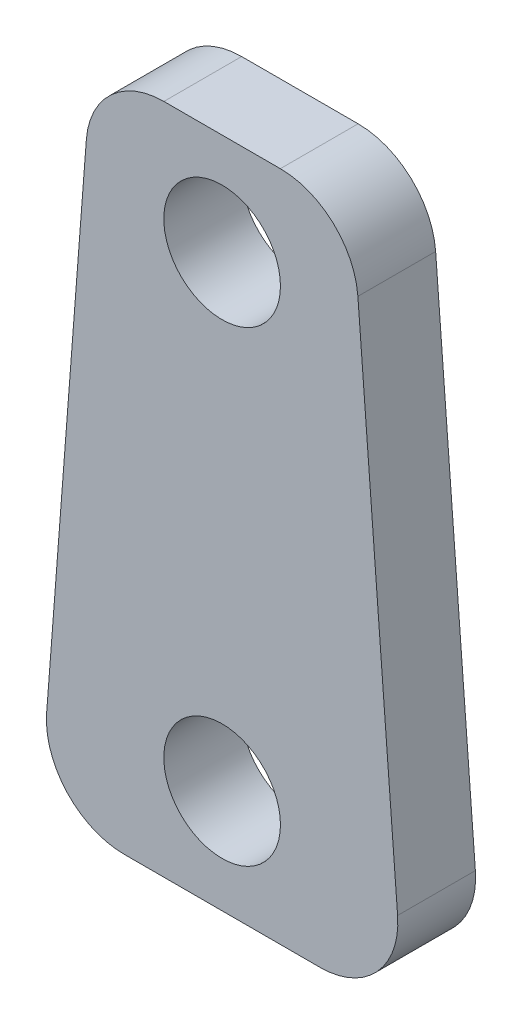
from build123d import *

# Parameters (mm, degrees)
BOSS_EXTRUDE1_DEPTH = 3.175


with BuildPart() as part:
    # Sketch1 → Boss-Extrude1 (new body)
    with BuildSketch(Plane.XY):
        with BuildLine():
            Line((0, 135.477250085), (0, 137.244666667))
            Line((0, 137.244666667), (-2.377569082, 137.244666667))
            ThreePointArc((-2.377569082, 137.244666667), (-4.534821542, 136.399234614), (-5.543217073, 134.313178051))
            Line((-5.543217073, 134.313178051), (-7.164909381, 113.231178051))
            ThreePointArc((-7.164909381, 113.231178051), (-6.328829337, 110.830414206), (-3.999261389, 109.812666667))
            Line((-3.999261389, 109.812666667), (0, 109.812666667))
            Line((0, 109.812666667), (0, 111.664750085))
            ThreePointArc((0, 111.664750085), (-2.38125, 114.046000085), (0, 116.427250085))
            Line((0, 116.427250085), (0, 130.714750085))
            ThreePointArc((0, 130.714750085), (-2.38125, 133.096000085), (0, 135.477250085))
        make_face()
        with BuildLine():
            Line((7.164909381, 113.231178051), (5.543217073, 134.313178051))
            ThreePointArc((5.543217073, 134.313178051), (4.534821542, 136.399234614), (2.377569082, 137.244666667))
            Line((2.377569082, 137.244666667), (0, 137.244666667))
            Line((0, 137.244666667), (0, 135.477250085))
            ThreePointArc((0, 135.477250085), (1.683798023, 134.779798107), (2.38125, 133.096000085))
            ThreePointArc((2.38125, 133.096000085), (1.683798023, 131.412202062), (0, 130.714750085))
            Line((0, 130.714750085), (0, 116.427250085))
            ThreePointArc((0, 116.427250085), (1.683798023, 115.729798107), (2.38125, 114.046000085))
            ThreePointArc((2.38125, 114.046000085), (1.683798023, 112.362202062), (0, 111.664750085))
            Line((0, 111.664750085), (0, 109.812666667))
            Line((0, 109.812666667), (3.999261389, 109.812666667))
            ThreePointArc((3.999261389, 109.812666667), (6.328829337, 110.830414206), (7.164909381, 113.231178051))
        make_face()
    extrude(amount=BOSS_EXTRUDE1_DEPTH)


solid = part.part
